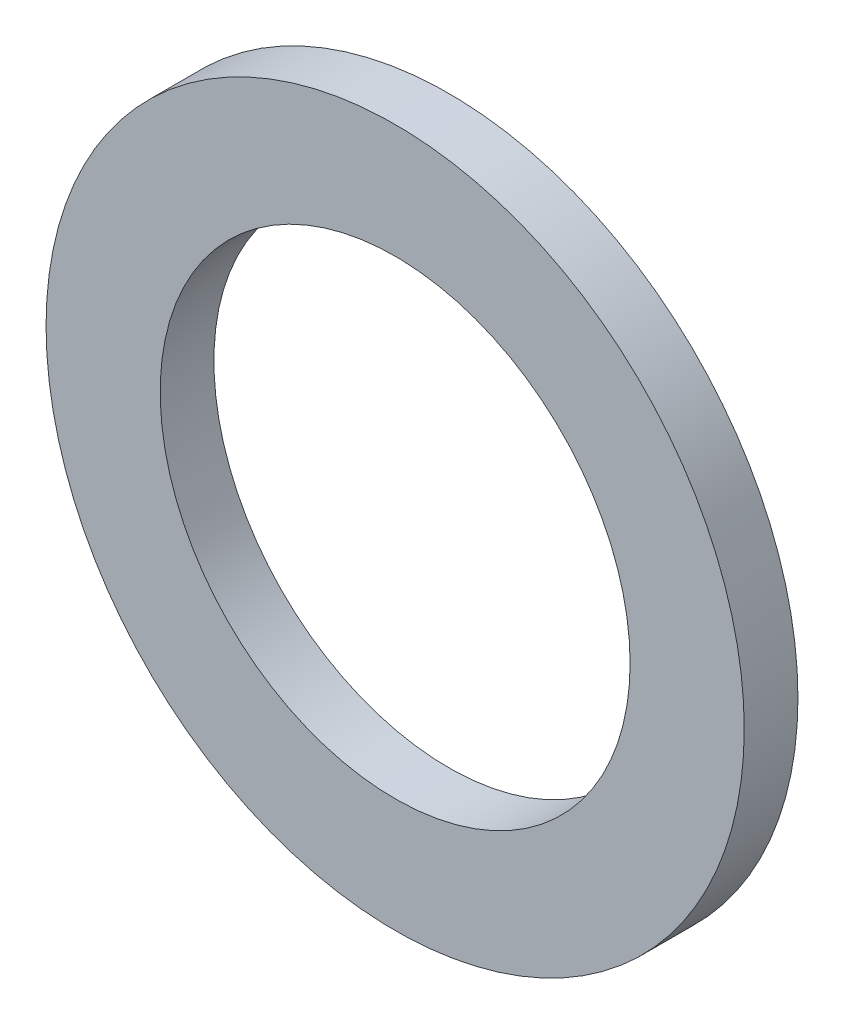
from build123d import *

# Parameters (mm, degrees)
SKETCH1_R           = 26
SKETCH1_R_2         = 17.5
BOSS_EXTRUDE1_DEPTH = 4


with BuildPart() as part:
    # Sketch1 → Boss-Extrude1 (new body)
    with BuildSketch(Plane.XY):
        Circle(SKETCH1_R)
        Circle(SKETCH1_R_2, mode=Mode.SUBTRACT)
    extrude(amount=BOSS_EXTRUDE1_DEPTH)


solid = part.part
